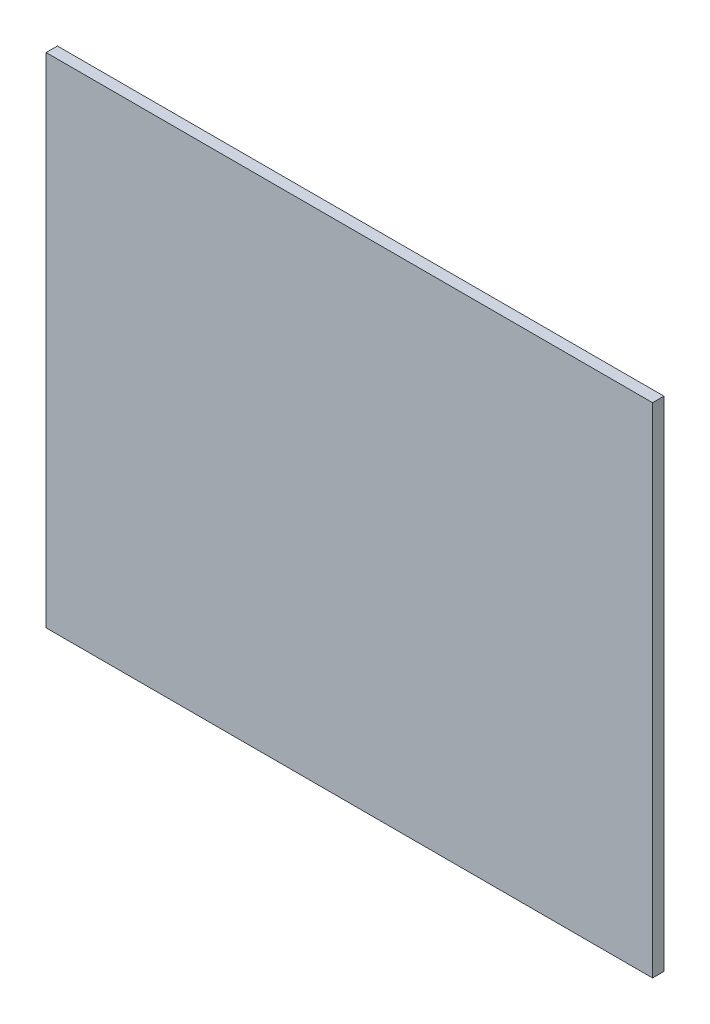
from build123d import *

# Parameters (mm, degrees)
SKETCH1_W           = 964
SKETCH1_H           = 792
BOSS_EXTRUDE1_DEPTH = 18


with BuildPart() as part:
    # Sketch1 → Boss-Extrude1 (new body)
    with BuildSketch(Plane.XY):
        with Locations((482, 396)):
            Rectangle(SKETCH1_W, SKETCH1_H)
    extrude(amount=BOSS_EXTRUDE1_DEPTH)


solid = part.part
